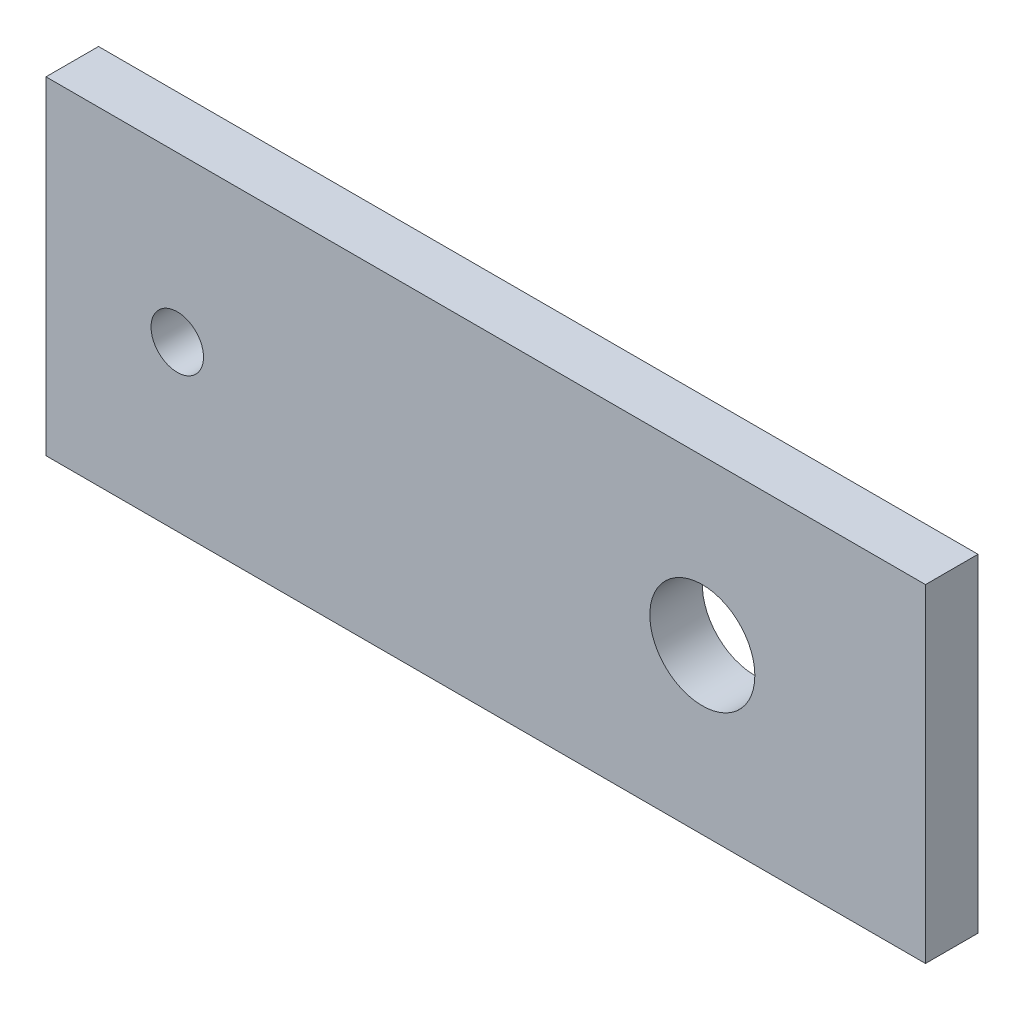
from build123d import *

# Parameters (mm, degrees)
SKETCH_1_W          = 67
SKETCH_1_H          = 25
EXTRUDE_1_DEPTH     = 4
SKETCH_2_R          = 2
SKETCH_2_R_2        = 4
CUT_EXTRUDE_1_DEPTH = 4


with BuildPart() as part:
    # 草图1 → 凸台-拉伸1 (new body)
    with BuildSketch(Plane.XY):
        with Locations((-11.34407729, 17.956602493)):
            Rectangle(SKETCH_1_W, SKETCH_1_H)
    extrude(amount=EXTRUDE_1_DEPTH)

    # 草图2 → 切除-拉伸1 (cut)
    with BuildSketch(Plane.XY.offset(4)):
        with Locations((-34.84407729, 17.956602493)):
            Circle(SKETCH_2_R)
        with Locations((5.15592271, 17.956602493)):
            Circle(SKETCH_2_R_2)
    extrude(amount=-CUT_EXTRUDE_1_DEPTH, mode=Mode.SUBTRACT)


solid = part.part
